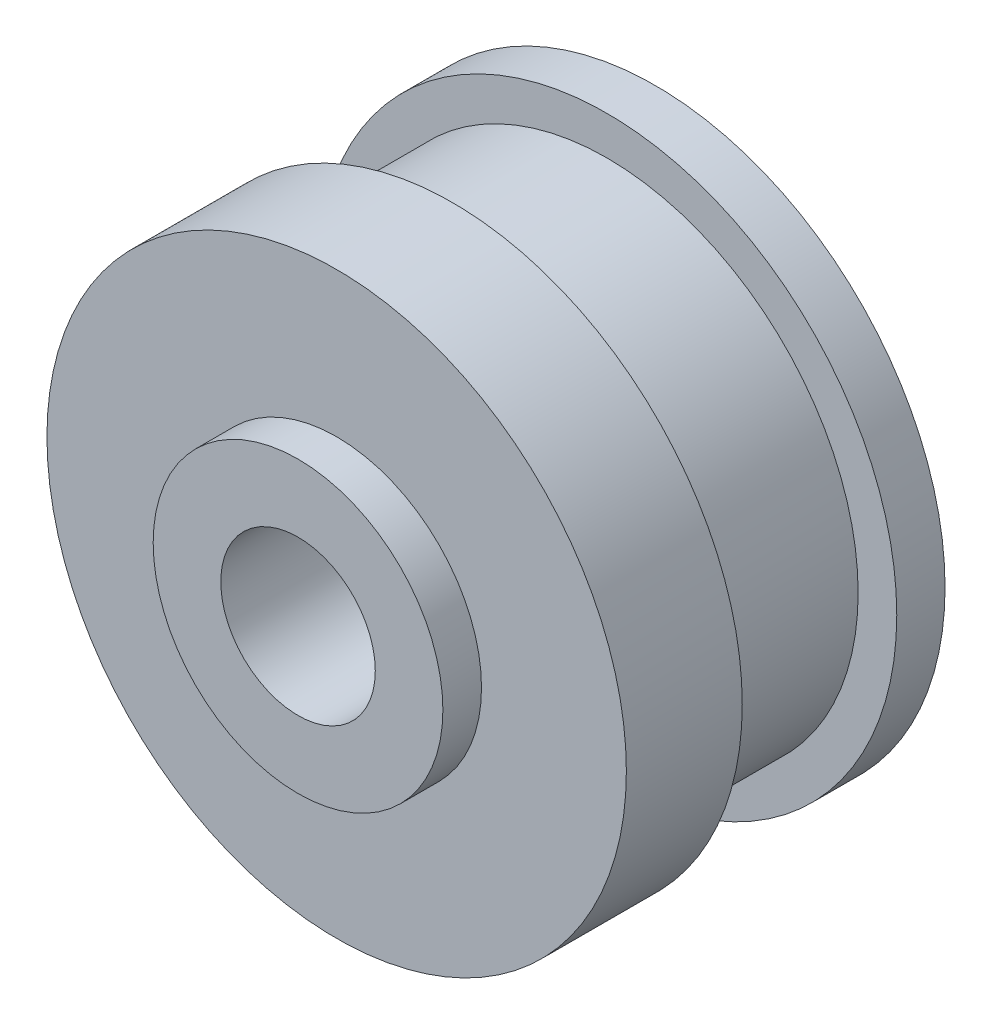
from build123d import *

# Parameters (mm, degrees)
SKIZZE1_R                       = 15
AUFSATZ_LINEAR_AUSTRAGEN1_DEPTH = 16.5
SCHNITT_LINEAR_AUSTRAGEN1_REACH = 28.875
SKIZZE2_R                       = 4
AUFSATZ_LINEAR_START            = 2
SKIZZE4_R                       = 7.5
SKIZZE4_R_2                     = 4
AUFSATZ_LINEAR_AUSTRAGEN2_DEPTH = 2
SKIZZE3_W                       = 2
SKIZZE3_H                       = 8


with BuildPart() as part:
    # Skizze1 → Aufsatz-Linear austragen1 (new body)
    with BuildSketch(Plane(origin=(0, 0, 0), x_dir=(0, 1, 0), z_dir=(0, 0, 1))):
        with Locations(Location((0, 0, 0), (0, 0, 270))):
            Circle(SKIZZE1_R)
    extrude(amount=AUFSATZ_LINEAR_AUSTRAGEN1_DEPTH)

    # Skizze2 → Schnitt-Linear austragen1 (cut, up to next)
    with BuildSketch(Plane.XY.offset(16.5), mode=Mode.PRIVATE) as schnitt_linear_austragen1_sk1:
        Circle(SKIZZE2_R)
    schnitt_linear_austragen1_tool1 = extrude(schnitt_linear_austragen1_sk1.sketch, amount=-SCHNITT_LINEAR_AUSTRAGEN1_REACH, mode=Mode.PRIVATE) & part.part
    add(schnitt_linear_austragen1_tool1.solids().sort_by_distance((0, 0, 16.5))[0], mode=Mode.SUBTRACT)

    # Skizze4 → Aufsatz-Linear austragen2 (add)
    with BuildSketch(Plane.XY.offset(16.5).offset(AUFSATZ_LINEAR_START)):
        Circle(SKIZZE4_R)
        Circle(SKIZZE4_R_2, mode=Mode.SUBTRACT)
    extrude(amount=-AUFSATZ_LINEAR_AUSTRAGEN2_DEPTH)

    # Skizze3 → Schnitt-Rotation1 (revolve, cut)
    with BuildSketch(Plane(origin=(0, 0, 0), x_dir=(-1, 0, 0), z_dir=(0, 1, 0)), mode=Mode.PRIVATE) as schnitt_rotation1_sk:
        with Locations((-14, 6.5)):
            Rectangle(SKIZZE3_W, SKIZZE3_H)
    revolve(schnitt_rotation1_sk.sketch.rotate(Axis((0, 0, 0), (0, 0, 1)), 180), axis=Axis((0, 0, 0), (0, 0, 1)), mode=Mode.SUBTRACT)


solid = part.part
